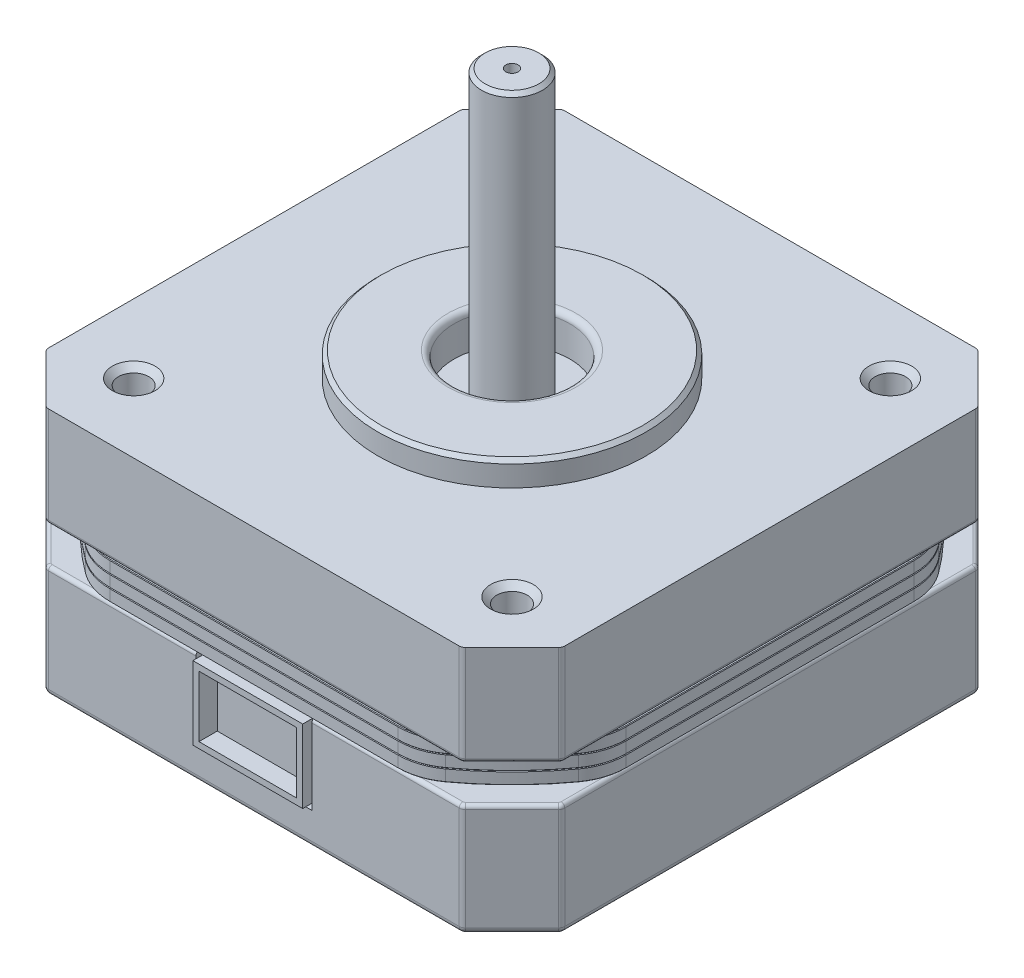
from build123d import *

# Parameters (mm, degrees)
EXTRUDE_1_DEPTH        = 9.2
EXTRUDE_START          = 20.4
EXTRUDE_2_DEPTH        = 8.2
EXTRUDE_3_DEPTH        = 1
PATTERN_LINEAR_1_COUNT = 3
PATTERN_LINEAR_1_PITCH = 1
SKETCH_3_R             = 4.75
CUT_EXTRUDE_1_DEPTH    = 3
SKETCH_4_R             = 4.75
SKETCH_4_R_2           = 2.5
CUT_EXTRUDE_2_DEPTH    = 0.5
SKETCH_5_R             = 0.5
CUT_EXTRUDE_3_DEPTH    = 0.5
CHAMFER_1_SIZE         = 0.3
FILLET_1_R             = 0.5
FILLET_2_R             = 0.5
SKETCH_6_R             = 11
SKETCH_6_R_2           = 4.75
EXTRUDE_4_DEPTH        = 2
CUT_EXTRUDE_START      = -1
SKETCH_7_R             = 4.75
CUT_EXTRUDE_4_DEPTH    = 1
CHAMFER_2_SIZE         = 0.3
FILLET_3_R             = 0.5
SKETCH_8_R             = 2.5
EXTRUDE_5_DEPTH        = 23
CHAMFER_4_SIZE         = 0.3
SKETCH_9_R             = 0.5
CUT_EXTRUDE_5_DEPTH    = 1
SKETCH_10_W            = 9.5
SKETCH_10_H            = 6.5
CUT_EXTRUDE_6_DEPTH    = 1
SKETCH_11_W            = 9
SKETCH_11_H            = 6
SKETCH_11_W_2          = 8
SKETCH_11_H_2          = 5
EXTRUDE_6_DEPTH        = 1.5
CHAMFER_32_SIZE        = 0.05
CHAMFER_33_SIZE        = 0.05
CHAMFER_34_SIZE        = 0.05
SKETCH_16_R            = 1.25
CUT_EXTRUDE_9_DEPTH    = 7
CHAMFER_35_SIZE        = 0.5
FILLET_4_R             = 0.3
FILLET_5_R             = 0.3


with BuildPart() as part:
    # Эскиз1 → Бобышка-Вытянуть1 (new body)
    with BuildSketch(Plane(origin=(0, 0, 0), x_dir=(1, 0, 0), z_dir=(0, 1, 0))):
        Polygon((-17.033766184, 21.15), (-21.15, 17.033766184), (-21.15, -17.033766184), (-17.033766184, -21.15), (17.033766184, -21.15), (21.15, -17.033766184), (21.15, 17.033766184), (17.033766184, 21.15), align=None)
    extrude(amount=EXTRUDE_1_DEPTH)

    # Эскиз3 → Вырез-Вытянуть1 (cut)
    with BuildSketch(Plane.XZ):
        with Locations(Location((0, 0, 0), (0, 0, 270))):
            Circle(SKETCH_3_R)
    extrude(amount=-CUT_EXTRUDE_1_DEPTH, mode=Mode.SUBTRACT)

    # Эскиз4 → Вырез-Вытянуть2 (cut)
    with BuildSketch(Plane.XZ.offset(-3)):
        with Locations(Location((0, 0, 0), (0, 0, 270))):
            Circle(SKETCH_4_R)
        with Locations(Location((0, 0, 0), (0, 0, 270))):
            Circle(SKETCH_4_R_2, mode=Mode.SUBTRACT)
    extrude(amount=-CUT_EXTRUDE_2_DEPTH, mode=Mode.SUBTRACT)

    # Эскиз5 → Вырез-Вытянуть3 (cut)
    with BuildSketch(Plane.XZ.offset(-3)):
        with Locations(Location((0, 0, 0), (0, 0, 270))):
            Circle(SKETCH_5_R)
    extrude(amount=-CUT_EXTRUDE_3_DEPTH, mode=Mode.SUBTRACT)

    # Фаска1
    chamfer_1_edges = [part.edges().sort_by_distance(p)[0] for p in [
        (0, 3, 2.5),
    ]]
    chamfer(chamfer_1_edges, length=CHAMFER_1_SIZE)

    # Скругление1
    fillet_1_edges = [part.edges().sort_by_distance(p)[0] for p in [
        (-21.15, 0, 0),
        (-19.091883092, 0, -19.091883092),
        (0, 0, -21.15),
        (19.091883092, 0, -19.091883092),
        (21.15, 0, 0),
        (19.091883092, 0, 19.091883092),
        (0, 0, 21.15),
        (-19.091883092, 0, 19.091883092),
        (-21.15, 4.6, 17.033766184),
        (-21.15, 4.6, -17.033766184),
        (-17.033766184, 4.6, -21.15),
        (17.033766184, 4.6, -21.15),
        (21.15, 4.6, -17.033766184),
        (21.15, 4.6, 17.033766184),
        (17.033766184, 4.6, 21.15),
        (-17.033766184, 4.6, 21.15),
        (0, 0, 4.75),
    ]]
    fillet(fillet_1_edges, radius=FILLET_1_R)

    # Эскиз10 → Вырез-Вытянуть6 (cut)
    with BuildSketch(Plane.XY.offset(21.15)):
        with Locations((0, 5.95)):
            Rectangle(SKETCH_10_W, SKETCH_10_H)
    extrude(amount=-CUT_EXTRUDE_6_DEPTH, mode=Mode.SUBTRACT)

    # Скругление4
    fillet_4_edges = [part.edges().sort_by_distance(p)[0] for p in [
        (10.788329701, 9.2, 21.15),
        (-10.788329701, 9.2, 21.15),
        (19.091883092, 9.2, 19.091883092),
        (21.15, 9.2, 0),
        (19.091883092, 9.2, -19.091883092),
        (0, 9.2, -21.15),
        (-19.091883092, 9.2, -19.091883092),
        (-21.15, 9.2, 0),
        (-19.091883092, 9.2, 19.091883092),
        (21.111939766, 9.2, -17.018001119),
        (17.018001119, 9.2, -21.111939766),
        (-17.018001119, 9.2, -21.111939766),
        (-21.111939766, 9.2, -17.018001119),
        (-21.111939766, 9.2, 17.018001119),
        (-17.018001119, 9.2, 21.111939766),
        (17.018001119, 9.2, 21.111939766),
        (21.111939766, 9.2, 17.018001119),
    ]]
    fillet(fillet_4_edges, radius=FILLET_4_R)


with BuildPart() as body_2:
    # Эскиз1<3> → Бобышка-Вытянуть2 (new body)
    with BuildSketch(Plane(origin=(0, 0, 0), x_dir=(1, 0, 0), z_dir=(0, 1, 0)).offset(EXTRUDE_START)):
        Polygon((-17.033766184, 21.15), (-21.15, 17.033766184), (-21.15, -17.033766184), (-17.033766184, -21.15), (17.033766184, -21.15), (21.15, -17.033766184), (21.15, 17.033766184), (17.033766184, 21.15), align=None)
    extrude(amount=-EXTRUDE_2_DEPTH)

    # Скругление2
    fillet_2_edges = [body_2.edges().sort_by_distance(p)[0] for p in [
        (-21.15, 16.3, 17.033766184),
        (-21.15, 16.3, -17.033766184),
        (-17.033766184, 16.3, -21.15),
        (17.033766184, 16.3, -21.15),
        (21.15, 16.3, -17.033766184),
        (21.15, 16.3, 17.033766184),
        (17.033766184, 16.3, 21.15),
        (-17.033766184, 16.3, 21.15),
    ]]
    fillet(fillet_2_edges, radius=FILLET_2_R)

    # Эскиз6 → Бобышка-Вытянуть4 (add)
    with BuildSketch(Plane(origin=(0, 20.4, 0), x_dir=(1, 0, 0), z_dir=(0, 1, 0))):
        with Locations(Location((0, 0, 0), (0, 0, 270))):
            Circle(SKETCH_6_R)
        with Locations(Location((0, 0, 0), (0, 0, 270))):
            Circle(SKETCH_6_R_2, mode=Mode.SUBTRACT)
    extrude(amount=EXTRUDE_4_DEPTH)

    # Эскиз7 → Вырез-Вытянуть4 (cut)
    with BuildSketch(Plane(origin=(0, 20.4, 0), x_dir=(1, 0, 0), z_dir=(0, 1, 0)).offset(CUT_EXTRUDE_START)):
        with Locations(Location((0, 0, 0), (0, 0, 270))):
            Circle(SKETCH_7_R)
    extrude(amount=CUT_EXTRUDE_4_DEPTH, mode=Mode.SUBTRACT)

    # Фаска2
    chamfer_2_edges = [body_2.edges().sort_by_distance(p)[0] for p in [
        (0, 22.4, -11),
    ]]
    chamfer(chamfer_2_edges, length=CHAMFER_2_SIZE)

    # Скругление3
    fillet_3_edges = [body_2.edges().sort_by_distance(p)[0] for p in [
        (0, 22.4, -4.75),
    ]]
    fillet(fillet_3_edges, radius=FILLET_3_R)

    # Эскиз8 → Бобышка-Вытянуть5 (add)
    with BuildSketch(Plane(origin=(0, 19.4, 0), x_dir=(1, 0, 0), z_dir=(0, 1, 0))):
        with Locations(Location((0, 0, 0), (0, 0, 270))):
            Circle(SKETCH_8_R)
    extrude(amount=EXTRUDE_5_DEPTH)

    # Фаска4
    chamfer_4_edges = [body_2.edges().sort_by_distance(p)[0] for p in [
        (0, 42.4, -2.5),
    ]]
    chamfer(chamfer_4_edges, length=CHAMFER_4_SIZE)

    # Эскиз9 → Вырез-Вытянуть5 (cut)
    with BuildSketch(Plane(origin=(0, 42.4, 0), x_dir=(1, 0, 0), z_dir=(0, 1, 0)).offset(CUT_EXTRUDE_START)):
        with Locations(Location((0, 0, 0), (0, 0, 270))):
            Circle(SKETCH_9_R)
    extrude(amount=CUT_EXTRUDE_5_DEPTH, mode=Mode.SUBTRACT)

    # Эскиз16 → Вырез-Вытянуть9 (cut)
    with BuildSketch(Plane(origin=(0, 20.4, 0), x_dir=(1, 0, 0), z_dir=(0, 1, 0))):
        with Locations(Location((-15.5, 15.5, 0), (0, 0, 270))):
            Circle(SKETCH_16_R)
        with Locations(Location((15.5, 15.5, 0), (0, 0, 270))):
            Circle(SKETCH_16_R)
        with Locations(Location((15.5, -15.5, 0), (0, 0, 270))):
            Circle(SKETCH_16_R)
        with Locations(Location((-15.5, -15.5, 0), (0, 0, 270))):
            Circle(SKETCH_16_R)
    extrude(amount=-CUT_EXTRUDE_9_DEPTH, mode=Mode.SUBTRACT)

    # Фаска35
    chamfer_35_edges = [body_2.edges().sort_by_distance(p)[0] for p in [
        (-15.5, 20.4, -16.75),
        (15.5, 20.4, -16.75),
        (15.5, 20.4, 14.25),
        (-15.5, 20.4, 14.25),
    ]]
    chamfer(chamfer_35_edges, length=CHAMFER_35_SIZE)

    # Скругление5
    fillet_5_edges = [body_2.edges().sort_by_distance(p)[0] for p in [
        (19.091883092, 12.2, 19.091883092),
        (21.15, 12.2, 0),
        (-19.091883092, 12.2, 19.091883092),
        (-21.15, 12.2, 0),
        (-19.091883092, 12.2, -19.091883092),
        (0, 12.2, -21.15),
        (19.091883092, 12.2, -19.091883092),
        (0, 12.2, 21.15),
        (21.111939766, 12.2, -17.018001119),
        (17.018001119, 12.2, -21.111939766),
        (-17.018001119, 12.2, -21.111939766),
        (-21.111939766, 12.2, -17.018001119),
        (-21.111939766, 12.2, 17.018001119),
        (-17.018001119, 12.2, 21.111939766),
        (17.018001119, 12.2, 21.111939766),
        (21.111939766, 12.2, 17.018001119),
    ]]
    fillet(fillet_5_edges, radius=FILLET_5_R)


with BuildPart() as body_3:
    # Эскиз2 → Бобышка-Вытянуть3 (new body)
    with BuildSketch(Plane(origin=(0, 9.2, 0), x_dir=(1, 0, 0), z_dir=(0, 1, 0))):
        with BuildLine():
            Line((-11.797351398, -21.15), (11.797351398, -21.15))
            ThreePointArc((11.797351398, -21.15), (13.348560603, -20.903288335), (14.746689247, -20.1875))
            ThreePointArc((14.746689247, -20.1875), (17.67766953, -17.67766953), (20.1875, -14.746689247))
            ThreePointArc((20.1875, -14.746689247), (20.903288335, -13.348560603), (21.15, -11.797351398))
            Line((21.15, -11.797351398), (21.15, 11.797351398))
            ThreePointArc((21.15, 11.797351398), (20.903288335, 13.348560603), (20.1875, 14.746689247))
            ThreePointArc((20.1875, 14.746689247), (17.67766953, 17.67766953), (14.746689247, 20.1875))
            ThreePointArc((14.746689247, 20.1875), (13.348560603, 20.903288335), (11.797351398, 21.15))
            Line((11.797351398, 21.15), (-11.797351398, 21.15))
            ThreePointArc((-11.797351398, 21.15), (-13.348560603, 20.903288335), (-14.746689247, 20.1875))
            ThreePointArc((-14.746689247, 20.1875), (-17.67766953, 17.67766953), (-20.1875, 14.746689247))
            ThreePointArc((-20.1875, 14.746689247), (-20.903288335, 13.348560603), (-21.15, 11.797351398))
            Line((-21.15, 11.797351398), (-21.15, -11.797351398))
            ThreePointArc((-21.15, -11.797351398), (-20.903288335, -13.348560603), (-20.1875, -14.746689247))
            ThreePointArc((-20.1875, -14.746689247), (-17.67766953, -17.67766953), (-14.746689247, -20.1875))
            ThreePointArc((-14.746689247, -20.1875), (-13.348560603, -20.903288335), (-11.797351398, -21.15))
        make_face()
    extrude(amount=EXTRUDE_3_DEPTH)


with BuildPart() as pattern_linear_1_1:
    # Линейный массив1: pattern copy
    add(body_3.part.moved(Location(Vector(0, 1, 0) * (1 * PATTERN_LINEAR_1_PITCH))))

    # Фаска33
    chamfer_33_edges = [pattern_linear_1_1.edges().sort_by_distance(p)[0] for p in [
        (-13.348560603, 11.2, -20.903288335),
        (-17.67766953, 11.2, -17.67766953),
        (17.67766953, 10.2, -17.67766953),
        (20.903288335, 10.2, -13.348560603),
        (21.15, 10.2, 0),
        (20.903288335, 10.2, 13.348560603),
        (17.67766953, 10.2, 17.67766953),
        (-20.903288335, 11.2, -13.348560603),
        (13.348560603, 10.2, 20.903288335),
        (0, 10.2, 21.15),
        (-13.348560603, 10.2, 20.903288335),
        (-17.67766953, 10.2, 17.67766953),
        (-20.903288335, 10.2, 13.348560603),
        (-21.15, 10.2, 0),
        (-20.903288335, 10.2, -13.348560603),
        (-17.67766953, 10.2, -17.67766953),
        (-21.15, 11.2, 0),
        (-13.348560603, 10.2, -20.903288335),
        (0, 10.2, -21.15),
        (13.348560603, 10.2, -20.903288335),
        (-20.903288335, 11.2, 13.348560603),
        (-17.67766953, 11.2, 17.67766953),
        (-13.348560603, 11.2, 20.903288335),
        (0, 11.2, 21.15),
        (13.348560603, 11.2, 20.903288335),
        (17.67766953, 11.2, 17.67766953),
        (13.348560603, 11.2, -20.903288335),
        (20.903288335, 11.2, 13.348560603),
        (21.15, 11.2, 0),
        (20.903288335, 11.2, -13.348560603),
        (17.67766953, 11.2, -17.67766953),
        (0, 11.2, -21.15),
    ]]
    chamfer(chamfer_33_edges, length=CHAMFER_33_SIZE)


with BuildPart() as pattern_linear_1_2:
    # Линейный массив1: pattern copy
    add(body_3.part.moved(Location(Vector(0, 1, 0) * (2 * PATTERN_LINEAR_1_PITCH))))

    # Фаска32
    chamfer_32_edges = [pattern_linear_1_2.edges().sort_by_distance(p)[0] for p in [
        (-13.348560603, 12.2, -20.903288335),
        (-17.67766953, 12.2, -17.67766953),
        (17.67766953, 11.2, -17.67766953),
        (20.903288335, 11.2, -13.348560603),
        (21.15, 11.2, 0),
        (20.903288335, 11.2, 13.348560603),
        (17.67766953, 11.2, 17.67766953),
        (-20.903288335, 12.2, -13.348560603),
        (13.348560603, 11.2, 20.903288335),
        (0, 11.2, 21.15),
        (-13.348560603, 11.2, 20.903288335),
        (-17.67766953, 11.2, 17.67766953),
        (-20.903288335, 11.2, 13.348560603),
        (-21.15, 11.2, 0),
        (-20.903288335, 11.2, -13.348560603),
        (-17.67766953, 11.2, -17.67766953),
        (-21.15, 12.2, 0),
        (-13.348560603, 11.2, -20.903288335),
        (0, 11.2, -21.15),
        (13.348560603, 11.2, -20.903288335),
        (-20.903288335, 12.2, 13.348560603),
        (-17.67766953, 12.2, 17.67766953),
        (-13.348560603, 12.2, 20.903288335),
        (0, 12.2, 21.15),
        (13.348560603, 12.2, 20.903288335),
        (17.67766953, 12.2, 17.67766953),
        (13.348560603, 12.2, -20.903288335),
        (20.903288335, 12.2, 13.348560603),
        (21.15, 12.2, 0),
        (20.903288335, 12.2, -13.348560603),
        (17.67766953, 12.2, -17.67766953),
        (0, 12.2, -21.15),
    ]]
    chamfer(chamfer_32_edges, length=CHAMFER_32_SIZE)


with BuildPart() as body_6:
    # Эскиз11 → Бобышка-Вытянуть6 (new body)
    with BuildSketch(Plane.XY.offset(20.15)):
        with Locations((0, 5.95)):
            Rectangle(SKETCH_11_W, SKETCH_11_H)
        with Locations((0, 5.95)):
            Rectangle(SKETCH_11_W_2, SKETCH_11_H_2, mode=Mode.SUBTRACT)
    extrude(amount=EXTRUDE_6_DEPTH)


with BuildPart() as body_3_1:
    add(body_3.part)

    # Фаска34
    chamfer_34_edges = [body_3_1.edges().sort_by_distance(p)[0] for p in [
        (-13.348560603, 10.2, -20.903288335),
        (-17.67766953, 10.2, -17.67766953),
        (17.67766953, 9.2, -17.67766953),
        (20.903288335, 9.2, -13.348560603),
        (21.15, 9.2, 0),
        (20.903288335, 9.2, 13.348560603),
        (17.67766953, 9.2, 17.67766953),
        (-20.903288335, 10.2, -13.348560603),
        (13.348560603, 9.2, 20.903288335),
        (0, 9.2, 21.15),
        (-13.348560603, 9.2, 20.903288335),
        (-17.67766953, 9.2, 17.67766953),
        (-20.903288335, 9.2, 13.348560603),
        (-21.15, 9.2, 0),
        (-20.903288335, 9.2, -13.348560603),
        (-17.67766953, 9.2, -17.67766953),
        (-21.15, 10.2, 0),
        (-13.348560603, 9.2, -20.903288335),
        (0, 9.2, -21.15),
        (13.348560603, 9.2, -20.903288335),
        (-20.903288335, 10.2, 13.348560603),
        (-17.67766953, 10.2, 17.67766953),
        (-13.348560603, 10.2, 20.903288335),
        (0, 10.2, 21.15),
        (13.348560603, 10.2, 20.903288335),
        (17.67766953, 10.2, 17.67766953),
        (13.348560603, 10.2, -20.903288335),
        (20.903288335, 10.2, 13.348560603),
        (21.15, 10.2, 0),
        (20.903288335, 10.2, -13.348560603),
        (17.67766953, 10.2, -17.67766953),
        (0, 10.2, -21.15),
    ]]
    chamfer(chamfer_34_edges, length=CHAMFER_34_SIZE)


solid = Compound([part.part, body_2.part, pattern_linear_1_1.part, pattern_linear_1_2.part, body_6.part, body_3_1.part])
